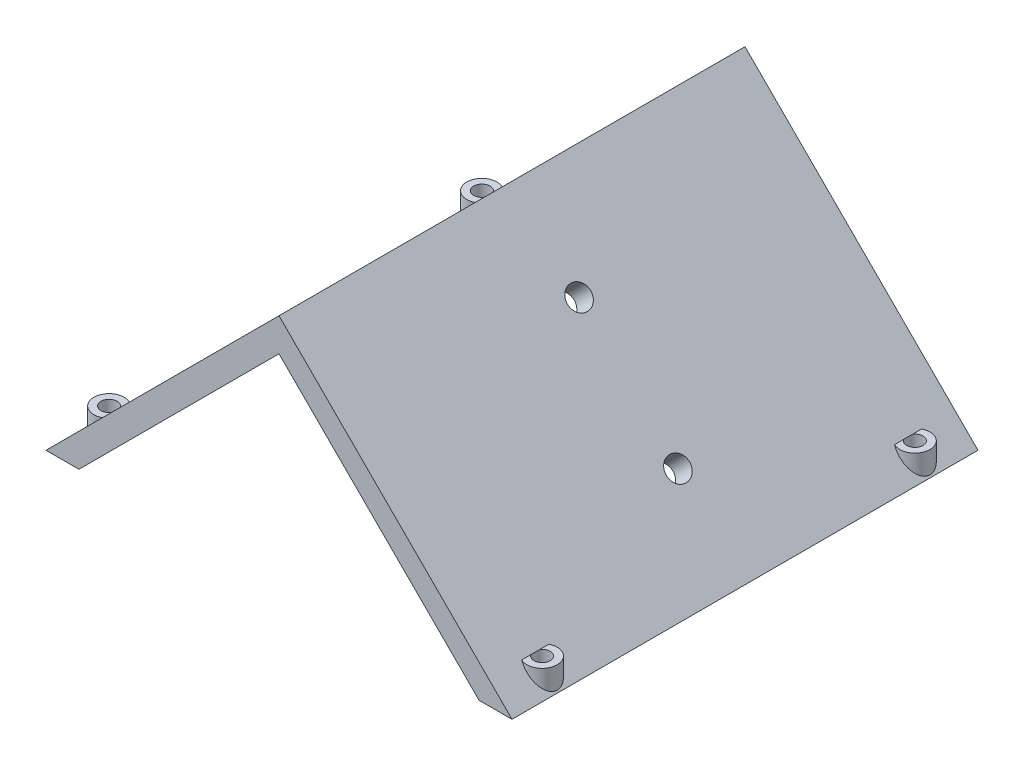
from build123d import *

# Parameters (mm, degrees)
EXTRUDE_1_DEPTH     = 100
SKETCH_2_R          = 2.5
CUT_EXTRUDE_1_DEPTH = 100
SKETCH_3_R          = 3.25
SKETCH_3_R_2        = 1.75
EXTRUDE_2_DEPTH     = 5
SKETCH_4_R          = 1.75
CUT_EXTRUDE_3_DEPTH = 5
SKETCH_5_R          = 3.25
SKETCH_5_R_2        = 1.75
EXTRUDE_3_DEPTH     = 5
SKETCH_6_R          = 1.75
CUT_EXTRUDE_4_DEPTH = 5


with BuildPart() as part:
    # 草图1 → 凸台-拉伸1 (new body)
    with BuildSketch(Plane.XY):
        Polygon((0, 7.1), (50, 57.1), (100, 7.1), (92.928932188, 7.1), (50, 50.028932188), (7.071067812, 7.1), align=None)
    extrude(amount=EXTRUDE_1_DEPTH)

    # 草图2 → 切除-拉伸1 (cut)
    with BuildSketch(Plane(origin=(53.55, 53.55, 0), x_dir=(0, 0, -1), z_dir=(0.7071067811865474, 0.7071067811865477, 0))):
        with Locations(Location((-50, -15.334880913, 0), (0, 0, 90))):
            Circle(SKETCH_2_R)
        with Locations(Location((-50, -45.334880913, 0), (0, 0, 90))):
            Circle(SKETCH_2_R)
    extrude(amount=-CUT_EXTRUDE_1_DEPTH, mode=Mode.SUBTRACT)

    # 草图3 → 凸台-拉伸2 (add)
    # profile 1 of 2: a face of its own
    with BuildSketch(Plane.XZ.offset(-7.1)):
        with Locations((96.464466094, 90)):
            Circle(SKETCH_3_R)
        with Locations((96.464466094, 90)):
            Circle(SKETCH_3_R_2, mode=Mode.SUBTRACT)
    # profile 2 of 2: a face of its own
    with BuildSketch(Plane.XZ.offset(-7.1)):
        with Locations((96.464466094, 10)):
            Circle(SKETCH_3_R)
        with Locations((96.464466094, 10)):
            Circle(SKETCH_3_R_2, mode=Mode.SUBTRACT)
    extrude(amount=-EXTRUDE_2_DEPTH)

    # 草图4 → 切除-拉伸3 (cut)
    with BuildSketch(Plane.XZ.offset(-7.1)):
        with Locations((96.464466094, 90)):
            Circle(SKETCH_4_R)
        with Locations((96.464466094, 10)):
            Circle(SKETCH_4_R)
    extrude(amount=-CUT_EXTRUDE_3_DEPTH, mode=Mode.SUBTRACT)

    # 草图5 → 凸台-拉伸3 (add)
    # profile 1 of 2: a face of its own
    with BuildSketch(Plane.XZ.offset(-7.1)):
        with Locations((3.535533906, 90)):
            Circle(SKETCH_5_R)
        with Locations((3.535533906, 90)):
            Circle(SKETCH_5_R_2, mode=Mode.SUBTRACT)
    # profile 2 of 2: a face of its own
    with BuildSketch(Plane.XZ.offset(-7.1)):
        with Locations((3.535533906, 10)):
            Circle(SKETCH_5_R)
        with Locations((3.535533906, 10)):
            Circle(SKETCH_5_R_2, mode=Mode.SUBTRACT)
    extrude(amount=-EXTRUDE_3_DEPTH)

    # 草图6 → 切除-拉伸4 (cut)
    with BuildSketch(Plane.XZ.offset(-7.1)):
        with Locations((3.535533906, 10)):
            Circle(SKETCH_6_R)
        with Locations((3.535533906, 90)):
            Circle(SKETCH_6_R)
    extrude(amount=-CUT_EXTRUDE_4_DEPTH, mode=Mode.SUBTRACT)


solid = part.part
